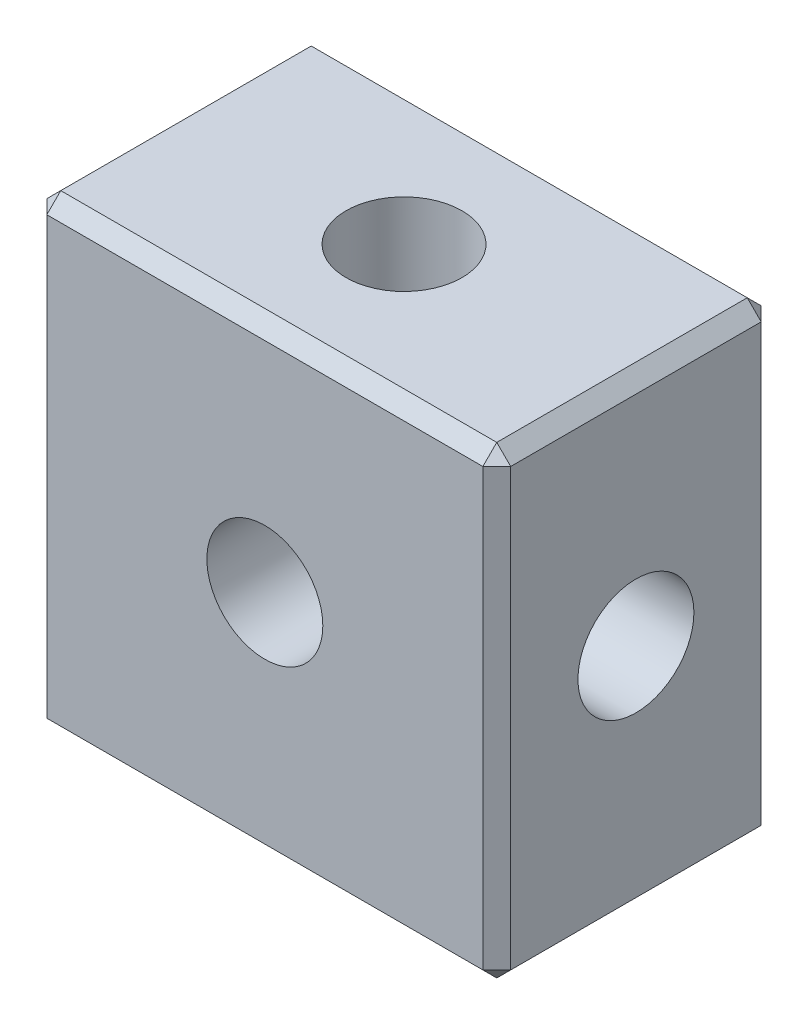
from build123d import *

# Parameters (mm, degrees)
SKETCH_1_W      = 10
SKETCH_1_H      = 10
EXTRUDE_1_DEPTH = 3
HOLE_WIZARD_1_D = 2.5
HOLE_WIZARD_2_D = 2.5
HOLE_WIZARD_3_D = 2.5
CHAMFER_1_SIZE  = 0.3


with BuildPart() as part:
    # 草图1 → 凸台-拉伸1 (new, symmetric)
    with BuildSketch(Plane.XY):
        Rectangle(SKETCH_1_W, SKETCH_1_H)
    extrude(amount=EXTRUDE_1_DEPTH, both=True)

    # 螺纹孔1 (through all)
    with Locations(Plane.XY.offset(3)):
        with Locations((0, 0)):
            Hole(HOLE_WIZARD_1_D / 2)

    # Hole Wizard 2 (through all)
    with Locations(Plane(origin=(5, 0, 0), x_dir=(0, 0, -1), z_dir=(1, 0, 0))):
        with Locations((0, 0)):
            Hole(HOLE_WIZARD_2_D / 2)

    # 螺纹孔3 (through all)
    with Locations(Plane(origin=(0, -5, 0), x_dir=(-1, 0, 0), z_dir=(0, -1, 0))):
        with Locations((0, 0)):
            Hole(HOLE_WIZARD_3_D / 2)

    # 倒角1
    chamfer_1_edges = [part.edges().sort_by_distance(p)[0] for p in [
        (-5, 0, 3),
        (0, -5, 3),
        (5, 0, 3),
        (0, -5, -3),
        (-5, 0, -3),
        (0, 5, -3),
        (5, 0, -3),
        (5, -5, 0),
        (-5, -5, 0),
        (-5, 5, 0),
        (5, 5, 0),
        (0, 5, 3),
    ]]
    chamfer(chamfer_1_edges, length=CHAMFER_1_SIZE)


solid = part.part
